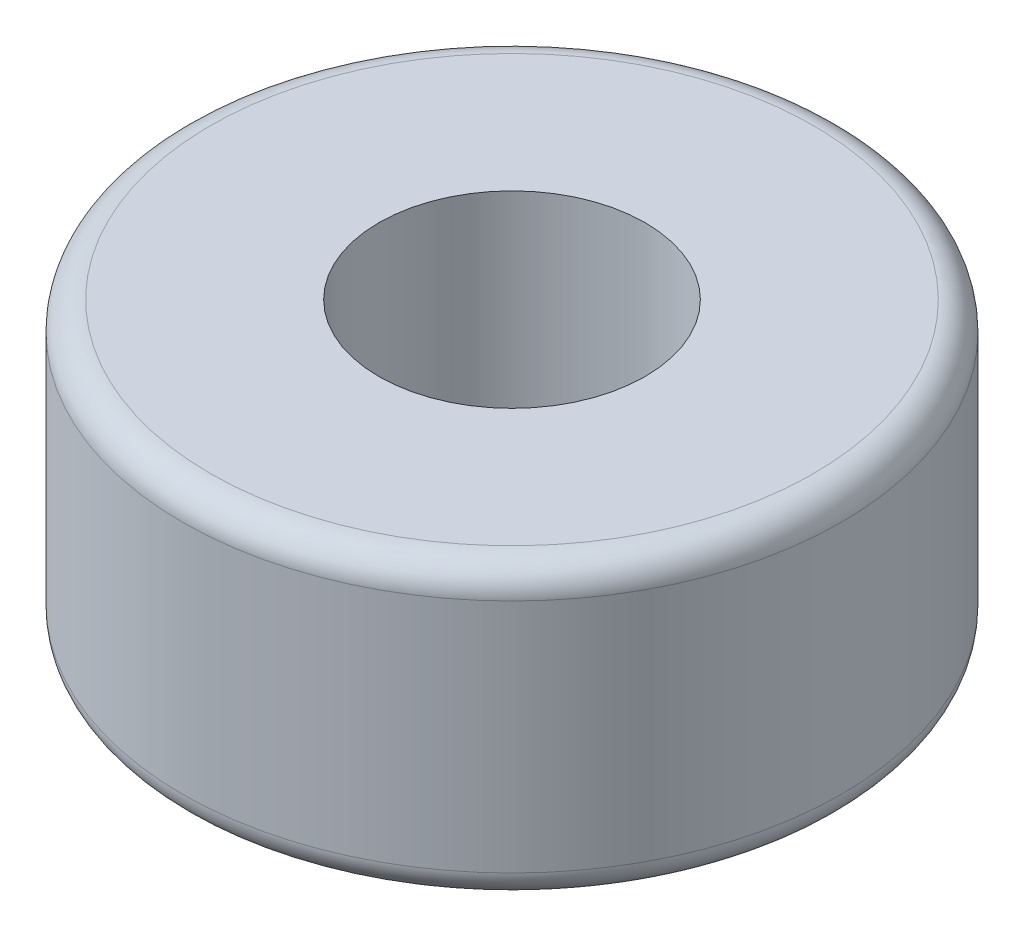
from build123d import *

# Parameters (mm, degrees)
SKETCH1_R           = 5.875
SKETCH1_R_2         = 2.375
BOSS_EXTRUDE1_DEPTH = 5.2
FILLET1_R           = 0.5


with BuildPart() as part:
    # Sketch1 → Boss-Extrude1 (new body)
    with BuildSketch(Plane(origin=(0, 0, 0), x_dir=(1, 0, 0), z_dir=(0, 1, 0))):
        with Locations(Location((0, 0, 0), (0, 0, 270))):
            Circle(SKETCH1_R)
        with Locations(Location((0, 0, 0), (0, 0, 270))):
            Circle(SKETCH1_R_2, mode=Mode.SUBTRACT)
    extrude(amount=BOSS_EXTRUDE1_DEPTH)

    # Fillet1
    fillet1_edges = [part.edges().sort_by_distance(p)[0] for p in [
        (0, 0, -5.875),
        (0, 5.2, -5.875),
    ]]
    fillet(fillet1_edges, radius=FILLET1_R)


solid = part.part
